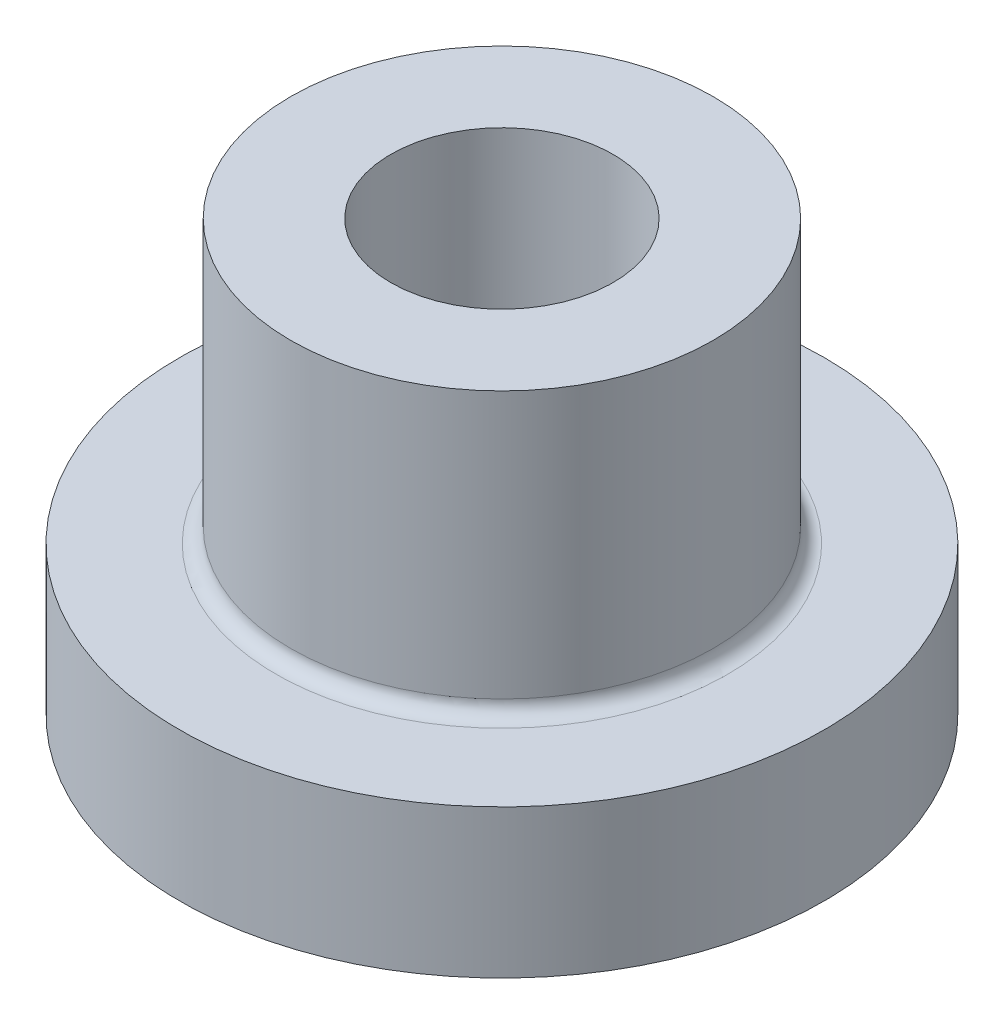
from build123d import *

# Parameters (mm, degrees)
SKETCH1_R                = 2.85
BOSS_EXTRUDE1_DEPTH      = 4.2
SHELL1_T                 = -1.35
BOSS_EXTRUDE2_DEPTH      = 1.6
BOSS_EXTRUDE2_DEPTH_BACK = 0.4
SKETCH2_R                = 4.35
SKETCH2_R_2              = 2.85
FILLET4_R                = 0.2


with BuildPart() as part:
    # Sketch1 → Boss-Extrude1 (new body)
    with BuildSketch(Plane(origin=(0, 0, 0), x_dir=(1, 0, 0), z_dir=(0, 1, 0))):
        with Locations(Location((0, 0, 0), (0, 0, 270))):
            Circle(SKETCH1_R)
    extrude(amount=BOSS_EXTRUDE1_DEPTH)

    # Shell1
    shell1_openings = [part.faces().sort_by_distance(p)[0] for p in [
        (0, 4.2, 0),
        (0, 0, 0),
    ]]
    offset(amount=SHELL1_T, openings=shell1_openings, kind=Kind.INTERSECTION)

    # Sketch2 → Boss-Extrude2 (add, two sides: drawn at the far end of the back side and taken through both)
    with BuildSketch(Plane.XZ.offset(-BOSS_EXTRUDE2_DEPTH_BACK)):
        with Locations(Location((0, 0, 0), (0, 0, 270))):
            Circle(SKETCH2_R)
        with Locations(Location((0, 0, 0), (0, 0, 270))):
            Circle(SKETCH2_R_2, mode=Mode.SUBTRACT)
    extrude(amount=BOSS_EXTRUDE2_DEPTH + BOSS_EXTRUDE2_DEPTH_BACK)

    # Fillet4
    fillet4_edges = [part.edges().sort_by_distance(p)[0] for p in [
        (0, 0.4, -2.85),
        (0, 0, 2.85),
    ]]
    fillet(fillet4_edges, radius=FILLET4_R)


solid = part.part
